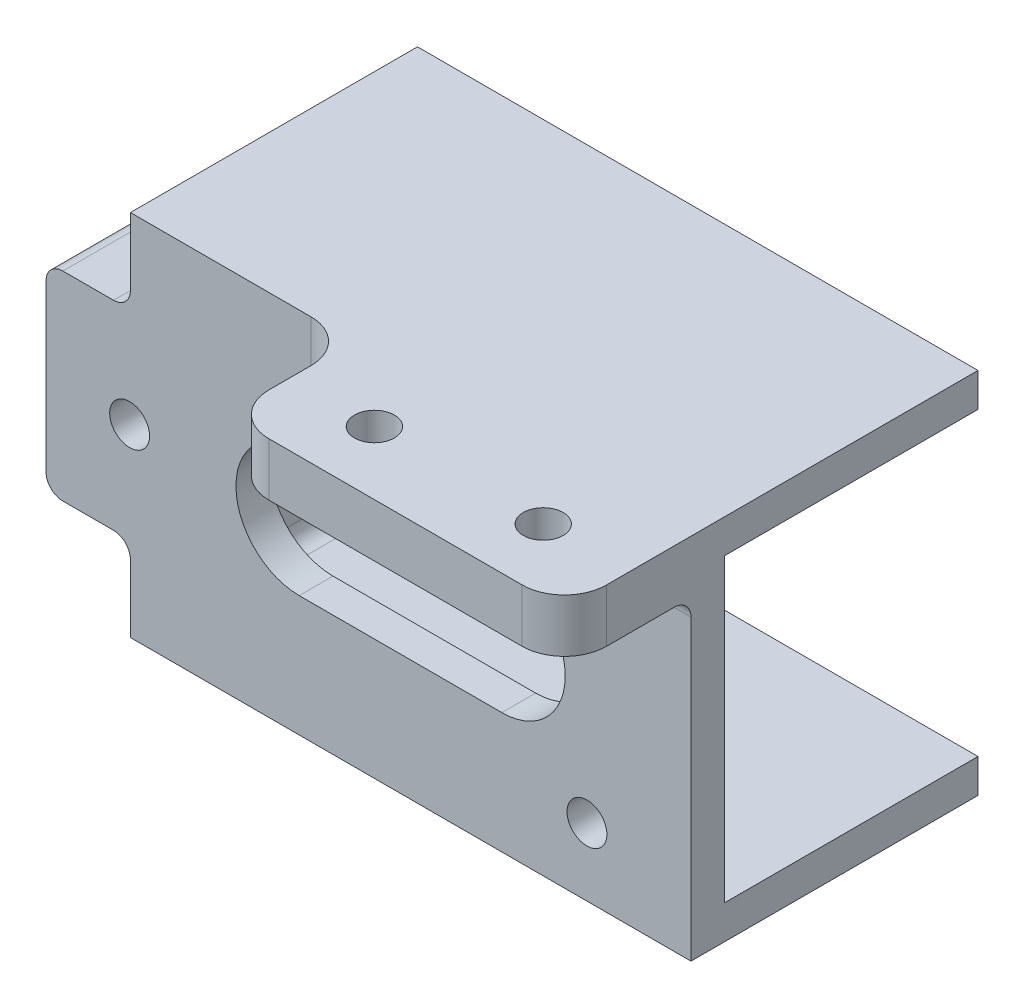
from build123d import *

# Parameters (mm, degrees)
BOSS_EXTRUDE1_DEPTH     = 19.05
SKETCH2_W               = 42.164
SKETCH2_H               = 27.686
BOSS_EXTRUDE2_DEPTH     = 2.54
SKETCH3_W               = 10.4
SKETCH3_H               = 14.986
BOSS_EXTRUDE3_DEPTH     = 6.35
CUT_EXTRUDE1_DEPTH      = 49.245194496
CUT_EXTRUDE1_DEPTH_BACK = 49.245194496
SKETCH4_R               = 1.5
FILLET2_R               = 1.27
CUT_EXTRUDE2_DEPTH      = 52.65763053
CUT_EXTRUDE2_DEPTH_BACK = 52.65763053
SKETCH5_R               = 4.7625
SKETCH6_W               = 25.4
SKETCH6_H               = 4
BOSS_EXTRUDE4_DEPTH     = 9.525
FILLET3_R               = 3.175
FILLET4_R               = 1.27
FILLET6_R               = 1.27
CUT_EXTRUDE3_DEPTH      = 58.486687197
CUT_EXTRUDE3_DEPTH_BACK = 58.486687197
SKETCH8_R               = 1.5
SKETCH9_W               = 2.54
SKETCH9_H               = 10.16
CUT_EXTRUDE4_DEPTH      = 11.19
CUT_EXTRUDE5_DEPTH      = 51.648644651
CUT_EXTRUDE5_DEPTH_BACK = 51.648644651
SKETCH10_R              = 1.5


with BuildPart() as part:
    # Sketch1 → Boss-Extrude1 (new body)
    with BuildSketch(Plane.XY):
        Polygon((-2.54, 25.146), (39.624, 25.146), (39.624, 22.606), (37.084, 22.606), (0, 22.606), (0, 0), (37.084, 0), (39.624, 0), (39.624, -2.54), (-2.54, -2.54), align=None)
    extrude(amount=BOSS_EXTRUDE1_DEPTH)

    # Sketch2 → Boss-Extrude2 (add)
    with BuildSketch(Plane.XY.offset(19.05)):
        with Locations((18.542, 11.303)):
            Rectangle(SKETCH2_W, SKETCH2_H)
    extrude(amount=BOSS_EXTRUDE2_DEPTH)

    # Sketch3 → Boss-Extrude3 (add)
    with BuildSketch(Plane.ZY.offset(2.54)):
        with Locations((16.39, 11.303)):
            Rectangle(SKETCH3_W, SKETCH3_H)
    extrude(amount=BOSS_EXTRUDE3_DEPTH)

    # Sketch4 → Cut-Extrude1 (cut, two sides: drawn at the far end of the back side and taken through both)
    with BuildSketch(Plane(origin=(0, 0, 11.19), x_dir=(-1, 0, 0), z_dir=(0, 0, -1)).offset(-CUT_EXTRUDE1_DEPTH_BACK)):
        with Locations(Location((2.6, 11.303, 0), (0, 0, 90))):
            Circle(SKETCH4_R)
    extrude(amount=CUT_EXTRUDE1_DEPTH + CUT_EXTRUDE1_DEPTH_BACK, mode=Mode.SUBTRACT)

    # Fillet2
    fillet2_edges = [part.edges().sort_by_distance(p)[0] for p in [
        (-2.54, 18.796, 16.39),
        (-2.54, 3.81, 16.39),
        (-8.89, 18.796, 16.39),
        (-8.89, 3.81, 16.39),
    ]]
    fillet(fillet2_edges, radius=FILLET2_R)

    # Sketch5 → Cut-Extrude2 (cut, two sides: drawn at the far end of the back side and taken through both)
    with BuildSketch(Plane.XY.offset(21.59).offset(-CUT_EXTRUDE2_DEPTH_BACK)):
        with Locations((10.16, 11.303)):
            Circle(SKETCH5_R)
        with BuildLine():
            Line((25.4, 16.0655), (10.16, 16.0655))
            ThreePointArc((10.16, 16.0655), (13.527596045, 14.670596045), (14.9225, 11.303))
            ThreePointArc((14.9225, 11.303), (13.527596045, 7.935403955), (10.16, 6.5405))
            Line((10.16, 6.5405), (25.4, 6.5405))
            ThreePointArc((25.4, 6.5405), (20.6375, 11.303), (25.4, 16.0655))
        make_face()
        with Locations((25.4, 11.303)):
            Circle(SKETCH5_R)
    extrude(amount=CUT_EXTRUDE2_DEPTH + CUT_EXTRUDE2_DEPTH_BACK, mode=Mode.SUBTRACT)

    # Sketch6 → Boss-Extrude4 (add)
    with BuildSketch(Plane.XY.offset(21.59)):
        with Locations((26.924, 23.146)):
            Rectangle(SKETCH6_W, SKETCH6_H)
    extrude(amount=BOSS_EXTRUDE4_DEPTH)

    # Fillet3
    fillet3_edges = [part.edges().sort_by_distance(p)[0] for p in [
        (14.224, 23.146, 21.59),
        (14.224, 23.146, 31.115),
        (39.624, 23.146, 31.115),
    ]]
    fillet(fillet3_edges, radius=FILLET3_R)

    # Fillet4
    fillet4_edges = [part.edges().sort_by_distance(p)[0] for p in [
        (25.3365, 21.146, 21.59),
    ]]
    fillet(fillet4_edges, radius=FILLET4_R)

    # Fillet6
    fillet6_edges = [part.edges().sort_by_distance(p)[0] for p in [
        (0, 0, 9.525),
        (0, 22.606, 9.525),
    ]]
    fillet(fillet6_edges, radius=FILLET6_R)

    # Sketch8 → Cut-Extrude3 (cut, two sides: drawn at the far end of the back side and taken through both)
    with BuildSketch(Plane(origin=(0, 25.146, 0), x_dir=(1, 0, 0), z_dir=(0, 1, 0)).offset(-CUT_EXTRUDE3_DEPTH_BACK)):
        with Locations(Location((20.574, -26.3525, 0), (0, 0, 270))):
            Circle(SKETCH8_R)
        with Locations(Location((33.274, -26.3525, 0), (0, 0, 270))):
            Circle(SKETCH8_R)
    extrude(amount=CUT_EXTRUDE3_DEPTH + CUT_EXTRUDE3_DEPTH_BACK, mode=Mode.SUBTRACT)

    # Sketch9 → Cut-Extrude4 (cut)
    with BuildSketch(Plane(origin=(0, 0, 0), x_dir=(-1, 0, 0), z_dir=(0, 0, -1))):
        with Locations((1.27, 11.303)):
            Rectangle(SKETCH9_W, SKETCH9_H)
    extrude(amount=-CUT_EXTRUDE4_DEPTH, mode=Mode.SUBTRACT)

    # Sketch10 → Cut-Extrude5 (cut, two sides: drawn at the far end of the back side and taken through both)
    with BuildSketch(Plane(origin=(0, 0, 19.05), x_dir=(-1, 0, 0), z_dir=(0, 0, -1)).offset(-CUT_EXTRUDE5_DEPTH_BACK)):
        with Locations(Location((-31.8, 2.55, 0), (0, 0, 180))):
            Circle(SKETCH10_R)
    extrude(amount=CUT_EXTRUDE5_DEPTH + CUT_EXTRUDE5_DEPTH_BACK, mode=Mode.SUBTRACT)


solid = part.part
